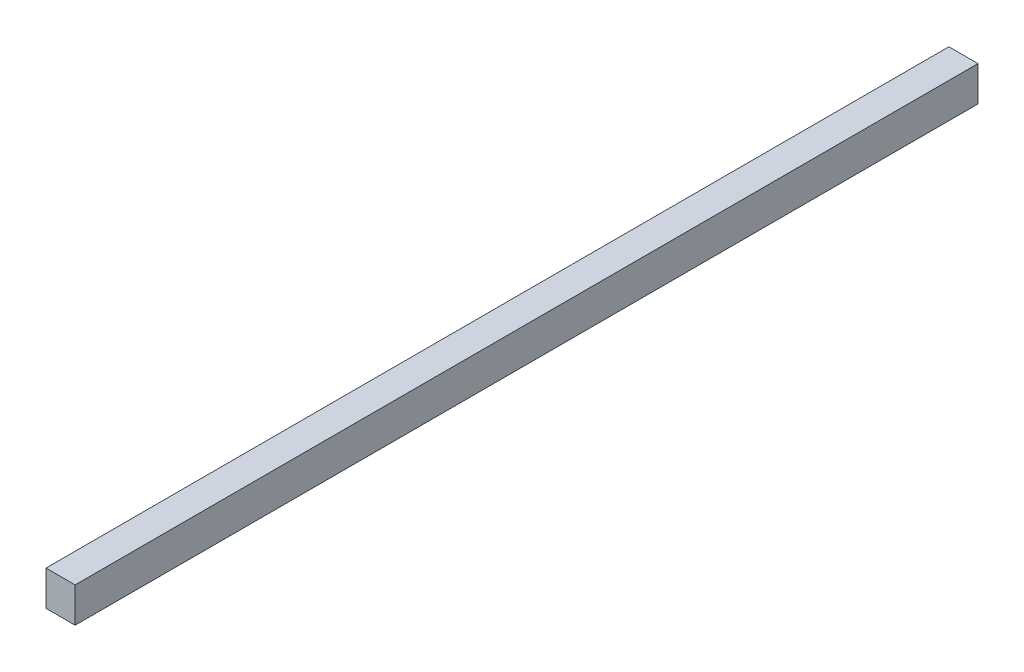
from build123d import *

# Parameters (mm, degrees)
SKETCH2_W           = 15
SKETCH2_H           = 18
BOSS_EXTRUDE1_DEPTH = 465


with BuildPart() as part:
    # Sketch2 → Boss-Extrude1 (new body)
    with BuildSketch(Plane.XY):
        Rectangle(SKETCH2_W, SKETCH2_H)
    extrude(amount=BOSS_EXTRUDE1_DEPTH)


solid = part.part
